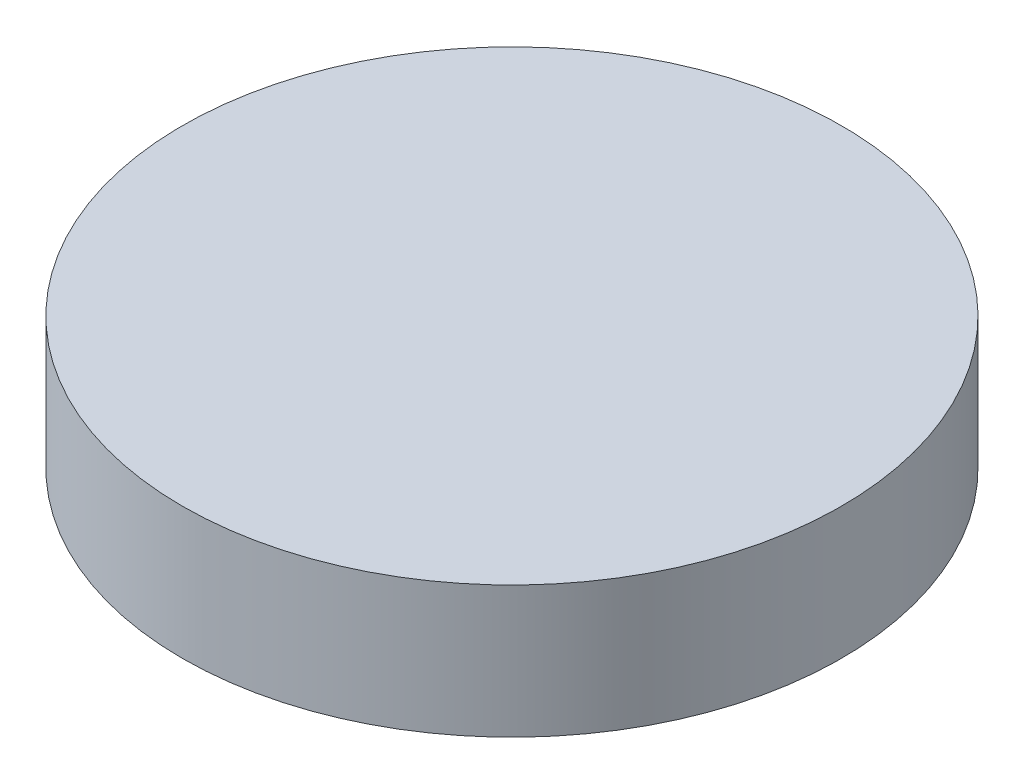
from build123d import *

# Parameters (mm, degrees)
SKETCH1_R           = 330
BOSS_EXTRUDE1_DEPTH = 132
SKETCH3_W           = 90
SKETCH3_H           = 90
BOSS_EXTRUDE2_DEPTH = 34


with BuildPart() as part:
    # Sketch1 → Boss-Extrude1 (new body)
    with BuildSketch(Plane(origin=(0, 0, 0), x_dir=(1, 0, 0), z_dir=(0, 1, 0))):
        with Locations(Location((0, 0, 0), (0, 0, 270))):
            Circle(SKETCH1_R)
    extrude(amount=BOSS_EXTRUDE1_DEPTH)

    # Sketch3 → Boss-Extrude2 (add)
    with BuildSketch(Plane.XZ):
        with Locations((25.993784752, 2.025345727)):
            Rectangle(SKETCH3_W, SKETCH3_H)
    extrude(amount=BOSS_EXTRUDE2_DEPTH)


solid = part.part
